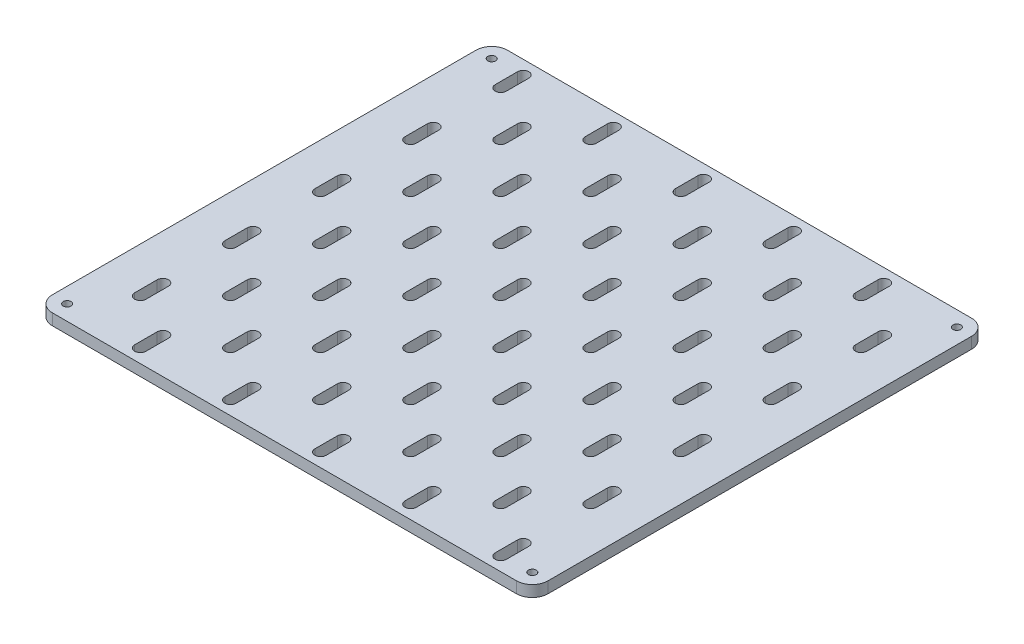
from build123d import *

# Parameters (mm, degrees)
SKETCH1_R                                           = 1.75
BOSS_EXTRUDE1_DEPTH                                 = 5
CSK_FOR_M3_COUNTERSUNK_FLAT_HEAD_SCREW1_D           = 3.2
CSK_FOR_M3_COUNTERSUNK_FLAT_HEAD_SCREW1_DEPTH       = 4
CSK_FOR_M3_COUNTERSUNK_FLAT_HEAD_SCREW1_CSINK_D     = 6.3
CSK_FOR_M3_COUNTERSUNK_FLAT_HEAD_SCREW1_CSINK_ANGLE = 90
CSK_FOR_M3_COUNTERSUNK_FLAT_HEAD_SCREW1_TIP         = 0.96137699


with BuildPart() as part:
    # Sketch1 → Boss-Extrude1 (new body)
    with BuildSketch(Plane(origin=(0, 0, 0), x_dir=(1, 0, 0), z_dir=(0, 1, 0))):
        with BuildLine():
            Line((7, 0), (213, 0))
            ThreePointArc((213, 0), (217.949747468, 2.050252532), (220, 7))
            Line((220, 7), (220, 195))
            ThreePointArc((220, 195), (217.949747468, 199.949747468), (213, 202))
            Line((213, 202), (7, 202))
            ThreePointArc((7, 202), (2.050252532, 199.949747468), (0, 195))
            Line((0, 195), (0, 7))
            ThreePointArc((0, 7), (2.050252532, 2.050252532), (7, 0))
        make_face()
        with Locations(Location((6.75, 195.25, 0), (0, 0, 270))):
            Circle(SKETCH1_R, mode=Mode.SUBTRACT)
        with Locations(Location((213.25, 195.25, 0), (0, 0, 270))):
            Circle(SKETCH1_R, mode=Mode.SUBTRACT)
        with Locations(Location((213.25, 6.75, 0), (0, 0, 270))):
            Circle(SKETCH1_R, mode=Mode.SUBTRACT)
        with Locations(Location((6.75, 6.75, 0), (0, 0, 270))):
            Circle(SKETCH1_R, mode=Mode.SUBTRACT)
        with BuildLine():
            Line((17.5, 186), (17.5, 196))
            ThreePointArc((17.5, 196), (20, 198.5), (22.5, 196))
            Line((22.5, 196), (22.5, 186))
            ThreePointArc((22.5, 186), (20, 183.5), (17.5, 186))
        make_face(mode=Mode.SUBTRACT)
        with BuildLine():
            Line((62.5, 186), (62.5, 196))
            ThreePointArc((62.5, 196), (60, 198.5), (57.5, 196))
            Line((57.5, 196), (57.5, 186))
            ThreePointArc((57.5, 186), (60, 183.5), (62.5, 186))
        make_face(mode=Mode.SUBTRACT)
        with BuildLine():
            Line((102.5, 186), (102.5, 196))
            ThreePointArc((102.5, 196), (100, 198.5), (97.5, 196))
            Line((97.5, 196), (97.5, 186))
            ThreePointArc((97.5, 186), (100, 183.5), (102.5, 186))
        make_face(mode=Mode.SUBTRACT)
        with BuildLine():
            Line((142.5, 186), (142.5, 196))
            ThreePointArc((142.5, 196), (140, 198.5), (137.5, 196))
            Line((137.5, 196), (137.5, 186))
            ThreePointArc((137.5, 186), (140, 183.5), (142.5, 186))
        make_face(mode=Mode.SUBTRACT)
        with BuildLine():
            Line((182.5, 186), (182.5, 196))
            ThreePointArc((182.5, 196), (180, 198.5), (177.5, 196))
            Line((177.5, 196), (177.5, 186))
            ThreePointArc((177.5, 186), (180, 183.5), (182.5, 186))
        make_face(mode=Mode.SUBTRACT)
        with BuildLine():
            Line((42.5, 176), (42.5, 166))
            ThreePointArc((42.5, 166), (40, 163.5), (37.5, 166))
            Line((37.5, 166), (37.5, 176))
            ThreePointArc((37.5, 176), (40, 178.5), (42.5, 176))
        make_face(mode=Mode.SUBTRACT)
        with BuildLine():
            Line((82.5, 176), (82.5, 166))
            ThreePointArc((82.5, 166), (80, 163.5), (77.5, 166))
            Line((77.5, 166), (77.5, 176))
            ThreePointArc((77.5, 176), (80, 178.5), (82.5, 176))
        make_face(mode=Mode.SUBTRACT)
        with BuildLine():
            Line((122.5, 176), (122.5, 166))
            ThreePointArc((122.5, 166), (120, 163.5), (117.5, 166))
            Line((117.5, 166), (117.5, 176))
            ThreePointArc((117.5, 176), (120, 178.5), (122.5, 176))
        make_face(mode=Mode.SUBTRACT)
        with BuildLine():
            Line((162.5, 176), (162.5, 166))
            ThreePointArc((162.5, 166), (160, 163.5), (157.5, 166))
            Line((157.5, 166), (157.5, 176))
            ThreePointArc((157.5, 176), (160, 178.5), (162.5, 176))
        make_face(mode=Mode.SUBTRACT)
        with BuildLine():
            Line((202.5, 176), (202.5, 166))
            ThreePointArc((202.5, 166), (200, 163.5), (197.5, 166))
            Line((197.5, 166), (197.5, 176))
            ThreePointArc((197.5, 176), (200, 178.5), (202.5, 176))
        make_face(mode=Mode.SUBTRACT)
        with BuildLine():
            Line((57.5, 146), (57.5, 156))
            ThreePointArc((57.5, 156), (60, 158.5), (62.5, 156))
            Line((62.5, 156), (62.5, 146))
            ThreePointArc((62.5, 146), (60, 143.5), (57.5, 146))
        make_face(mode=Mode.SUBTRACT)
        with BuildLine():
            Line((17.5, 146), (17.5, 156))
            ThreePointArc((17.5, 156), (20, 158.5), (22.5, 156))
            Line((22.5, 156), (22.5, 146))
            ThreePointArc((22.5, 146), (20, 143.5), (17.5, 146))
        make_face(mode=Mode.SUBTRACT)
        with BuildLine():
            Line((97.5, 146), (97.5, 156))
            ThreePointArc((97.5, 156), (100, 158.5), (102.5, 156))
            Line((102.5, 156), (102.5, 146))
            ThreePointArc((102.5, 146), (100, 143.5), (97.5, 146))
        make_face(mode=Mode.SUBTRACT)
        with BuildLine():
            Line((137.5, 146), (137.5, 156))
            ThreePointArc((137.5, 156), (140, 158.5), (142.5, 156))
            Line((142.5, 156), (142.5, 146))
            ThreePointArc((142.5, 146), (140, 143.5), (137.5, 146))
        make_face(mode=Mode.SUBTRACT)
        with BuildLine():
            Line((177.5, 146), (177.5, 156))
            ThreePointArc((177.5, 156), (180, 158.5), (182.5, 156))
            Line((182.5, 156), (182.5, 146))
            ThreePointArc((182.5, 146), (180, 143.5), (177.5, 146))
        make_face(mode=Mode.SUBTRACT)
        with BuildLine():
            Line((57.5, 106), (57.5, 116))
            ThreePointArc((57.5, 116), (60, 118.5), (62.5, 116))
            Line((62.5, 116), (62.5, 106))
            ThreePointArc((62.5, 106), (60, 103.5), (57.5, 106))
        make_face(mode=Mode.SUBTRACT)
        with BuildLine():
            Line((17.5, 106), (17.5, 116))
            ThreePointArc((17.5, 116), (20, 118.5), (22.5, 116))
            Line((22.5, 116), (22.5, 106))
            ThreePointArc((22.5, 106), (20, 103.5), (17.5, 106))
        make_face(mode=Mode.SUBTRACT)
        with BuildLine():
            Line((97.5, 106), (97.5, 116))
            ThreePointArc((97.5, 116), (100, 118.5), (102.5, 116))
            Line((102.5, 116), (102.5, 106))
            ThreePointArc((102.5, 106), (100, 103.5), (97.5, 106))
        make_face(mode=Mode.SUBTRACT)
        with BuildLine():
            Line((137.5, 106), (137.5, 116))
            ThreePointArc((137.5, 116), (140, 118.5), (142.5, 116))
            Line((142.5, 116), (142.5, 106))
            ThreePointArc((142.5, 106), (140, 103.5), (137.5, 106))
        make_face(mode=Mode.SUBTRACT)
        with BuildLine():
            Line((177.5, 106), (177.5, 116))
            ThreePointArc((177.5, 116), (180, 118.5), (182.5, 116))
            Line((182.5, 116), (182.5, 106))
            ThreePointArc((182.5, 106), (180, 103.5), (177.5, 106))
        make_face(mode=Mode.SUBTRACT)
        with BuildLine():
            Line((57.5, 66), (57.5, 76))
            ThreePointArc((57.5, 76), (60, 78.5), (62.5, 76))
            Line((62.5, 76), (62.5, 66))
            ThreePointArc((62.5, 66), (60, 63.5), (57.5, 66))
        make_face(mode=Mode.SUBTRACT)
        with BuildLine():
            Line((17.5, 66), (17.5, 76))
            ThreePointArc((17.5, 76), (20, 78.5), (22.5, 76))
            Line((22.5, 76), (22.5, 66))
            ThreePointArc((22.5, 66), (20, 63.5), (17.5, 66))
        make_face(mode=Mode.SUBTRACT)
        with BuildLine():
            Line((97.5, 66), (97.5, 76))
            ThreePointArc((97.5, 76), (100, 78.5), (102.5, 76))
            Line((102.5, 76), (102.5, 66))
            ThreePointArc((102.5, 66), (100, 63.5), (97.5, 66))
        make_face(mode=Mode.SUBTRACT)
        with BuildLine():
            Line((137.5, 66), (137.5, 76))
            ThreePointArc((137.5, 76), (140, 78.5), (142.5, 76))
            Line((142.5, 76), (142.5, 66))
            ThreePointArc((142.5, 66), (140, 63.5), (137.5, 66))
        make_face(mode=Mode.SUBTRACT)
        with BuildLine():
            Line((177.5, 66), (177.5, 76))
            ThreePointArc((177.5, 76), (180, 78.5), (182.5, 76))
            Line((182.5, 76), (182.5, 66))
            ThreePointArc((182.5, 66), (180, 63.5), (177.5, 66))
        make_face(mode=Mode.SUBTRACT)
        with BuildLine():
            Line((57.5, 26), (57.5, 36))
            ThreePointArc((57.5, 36), (60, 38.5), (62.5, 36))
            Line((62.5, 36), (62.5, 26))
            ThreePointArc((62.5, 26), (60, 23.5), (57.5, 26))
        make_face(mode=Mode.SUBTRACT)
        with BuildLine():
            Line((17.5, 26), (17.5, 36))
            ThreePointArc((17.5, 36), (20, 38.5), (22.5, 36))
            Line((22.5, 36), (22.5, 26))
            ThreePointArc((22.5, 26), (20, 23.5), (17.5, 26))
        make_face(mode=Mode.SUBTRACT)
        with BuildLine():
            Line((97.5, 26), (97.5, 36))
            ThreePointArc((97.5, 36), (100, 38.5), (102.5, 36))
            Line((102.5, 36), (102.5, 26))
            ThreePointArc((102.5, 26), (100, 23.5), (97.5, 26))
        make_face(mode=Mode.SUBTRACT)
        with BuildLine():
            Line((137.5, 26), (137.5, 36))
            ThreePointArc((137.5, 36), (140, 38.5), (142.5, 36))
            Line((142.5, 36), (142.5, 26))
            ThreePointArc((142.5, 26), (140, 23.5), (137.5, 26))
        make_face(mode=Mode.SUBTRACT)
        with BuildLine():
            Line((177.5, 26), (177.5, 36))
            ThreePointArc((177.5, 36), (180, 38.5), (182.5, 36))
            Line((182.5, 36), (182.5, 26))
            ThreePointArc((182.5, 26), (180, 23.5), (177.5, 26))
        make_face(mode=Mode.SUBTRACT)
        with BuildLine():
            Line((42.5, 136), (42.5, 126))
            ThreePointArc((42.5, 126), (40, 123.5), (37.5, 126))
            Line((37.5, 126), (37.5, 136))
            ThreePointArc((37.5, 136), (40, 138.5), (42.5, 136))
        make_face(mode=Mode.SUBTRACT)
        with BuildLine():
            Line((82.5, 136), (82.5, 126))
            ThreePointArc((82.5, 126), (80, 123.5), (77.5, 126))
            Line((77.5, 126), (77.5, 136))
            ThreePointArc((77.5, 136), (80, 138.5), (82.5, 136))
        make_face(mode=Mode.SUBTRACT)
        with BuildLine():
            Line((122.5, 136), (122.5, 126))
            ThreePointArc((122.5, 126), (120, 123.5), (117.5, 126))
            Line((117.5, 126), (117.5, 136))
            ThreePointArc((117.5, 136), (120, 138.5), (122.5, 136))
        make_face(mode=Mode.SUBTRACT)
        with BuildLine():
            Line((162.5, 136), (162.5, 126))
            ThreePointArc((162.5, 126), (160, 123.5), (157.5, 126))
            Line((157.5, 126), (157.5, 136))
            ThreePointArc((157.5, 136), (160, 138.5), (162.5, 136))
        make_face(mode=Mode.SUBTRACT)
        with BuildLine():
            Line((202.5, 136), (202.5, 126))
            ThreePointArc((202.5, 126), (200, 123.5), (197.5, 126))
            Line((197.5, 126), (197.5, 136))
            ThreePointArc((197.5, 136), (200, 138.5), (202.5, 136))
        make_face(mode=Mode.SUBTRACT)
        with BuildLine():
            Line((42.5, 96), (42.5, 86))
            ThreePointArc((42.5, 86), (40, 83.5), (37.5, 86))
            Line((37.5, 86), (37.5, 96))
            ThreePointArc((37.5, 96), (40, 98.5), (42.5, 96))
        make_face(mode=Mode.SUBTRACT)
        with BuildLine():
            Line((82.5, 96), (82.5, 86))
            ThreePointArc((82.5, 86), (80, 83.5), (77.5, 86))
            Line((77.5, 86), (77.5, 96))
            ThreePointArc((77.5, 96), (80, 98.5), (82.5, 96))
        make_face(mode=Mode.SUBTRACT)
        with BuildLine():
            Line((122.5, 96), (122.5, 86))
            ThreePointArc((122.5, 86), (120, 83.5), (117.5, 86))
            Line((117.5, 86), (117.5, 96))
            ThreePointArc((117.5, 96), (120, 98.5), (122.5, 96))
        make_face(mode=Mode.SUBTRACT)
        with BuildLine():
            Line((162.5, 96), (162.5, 86))
            ThreePointArc((162.5, 86), (160, 83.5), (157.5, 86))
            Line((157.5, 86), (157.5, 96))
            ThreePointArc((157.5, 96), (160, 98.5), (162.5, 96))
        make_face(mode=Mode.SUBTRACT)
        with BuildLine():
            Line((202.5, 96), (202.5, 86))
            ThreePointArc((202.5, 86), (200, 83.5), (197.5, 86))
            Line((197.5, 86), (197.5, 96))
            ThreePointArc((197.5, 96), (200, 98.5), (202.5, 96))
        make_face(mode=Mode.SUBTRACT)
        with BuildLine():
            Line((42.5, 56), (42.5, 46))
            ThreePointArc((42.5, 46), (40, 43.5), (37.5, 46))
            Line((37.5, 46), (37.5, 56))
            ThreePointArc((37.5, 56), (40, 58.5), (42.5, 56))
        make_face(mode=Mode.SUBTRACT)
        with BuildLine():
            Line((82.5, 56), (82.5, 46))
            ThreePointArc((82.5, 46), (80, 43.5), (77.5, 46))
            Line((77.5, 46), (77.5, 56))
            ThreePointArc((77.5, 56), (80, 58.5), (82.5, 56))
        make_face(mode=Mode.SUBTRACT)
        with BuildLine():
            Line((122.5, 56), (122.5, 46))
            ThreePointArc((122.5, 46), (120, 43.5), (117.5, 46))
            Line((117.5, 46), (117.5, 56))
            ThreePointArc((117.5, 56), (120, 58.5), (122.5, 56))
        make_face(mode=Mode.SUBTRACT)
        with BuildLine():
            Line((162.5, 56), (162.5, 46))
            ThreePointArc((162.5, 46), (160, 43.5), (157.5, 46))
            Line((157.5, 46), (157.5, 56))
            ThreePointArc((157.5, 56), (160, 58.5), (162.5, 56))
        make_face(mode=Mode.SUBTRACT)
        with BuildLine():
            Line((202.5, 56), (202.5, 46))
            ThreePointArc((202.5, 46), (200, 43.5), (197.5, 46))
            Line((197.5, 46), (197.5, 56))
            ThreePointArc((197.5, 56), (200, 58.5), (202.5, 56))
        make_face(mode=Mode.SUBTRACT)
        with BuildLine():
            Line((42.5, 16), (42.5, 6))
            ThreePointArc((42.5, 6), (40, 3.5), (37.5, 6))
            Line((37.5, 6), (37.5, 16))
            ThreePointArc((37.5, 16), (40, 18.5), (42.5, 16))
        make_face(mode=Mode.SUBTRACT)
        with BuildLine():
            Line((82.5, 16), (82.5, 6))
            ThreePointArc((82.5, 6), (80, 3.5), (77.5, 6))
            Line((77.5, 6), (77.5, 16))
            ThreePointArc((77.5, 16), (80, 18.5), (82.5, 16))
        make_face(mode=Mode.SUBTRACT)
        with BuildLine():
            Line((122.5, 16), (122.5, 6))
            ThreePointArc((122.5, 6), (120, 3.5), (117.5, 6))
            Line((117.5, 6), (117.5, 16))
            ThreePointArc((117.5, 16), (120, 18.5), (122.5, 16))
        make_face(mode=Mode.SUBTRACT)
        with BuildLine():
            Line((162.5, 16), (162.5, 6))
            ThreePointArc((162.5, 6), (160, 3.5), (157.5, 6))
            Line((157.5, 6), (157.5, 16))
            ThreePointArc((157.5, 16), (160, 18.5), (162.5, 16))
        make_face(mode=Mode.SUBTRACT)
        with BuildLine():
            Line((202.5, 16), (202.5, 6))
            ThreePointArc((202.5, 6), (200, 3.5), (197.5, 6))
            Line((197.5, 6), (197.5, 16))
            ThreePointArc((197.5, 16), (200, 18.5), (202.5, 16))
        make_face(mode=Mode.SUBTRACT)
    extrude(amount=BOSS_EXTRUDE1_DEPTH)

    # CSK for M3 Countersunk Flat Head Screw1
    with Locations(Plane(origin=(6.75, 0, -6.75), x_dir=(0, 0, -1), z_dir=(0, -1, 0))):
        with Locations((0, 0), (0, 206.5), (188.5, 0), (188.5, 206.5)):
            CounterSinkHole(CSK_FOR_M3_COUNTERSUNK_FLAT_HEAD_SCREW1_D / 2, CSK_FOR_M3_COUNTERSUNK_FLAT_HEAD_SCREW1_CSINK_D / 2, depth=CSK_FOR_M3_COUNTERSUNK_FLAT_HEAD_SCREW1_DEPTH, counter_sink_angle=CSK_FOR_M3_COUNTERSUNK_FLAT_HEAD_SCREW1_CSINK_ANGLE)
            with Locations((0, 0, -(CSK_FOR_M3_COUNTERSUNK_FLAT_HEAD_SCREW1_DEPTH + CSK_FOR_M3_COUNTERSUNK_FLAT_HEAD_SCREW1_TIP / 2))):  # 118° drill point
                Cone(0, CSK_FOR_M3_COUNTERSUNK_FLAT_HEAD_SCREW1_D / 2, CSK_FOR_M3_COUNTERSUNK_FLAT_HEAD_SCREW1_TIP, mode=Mode.SUBTRACT)


solid = part.part
